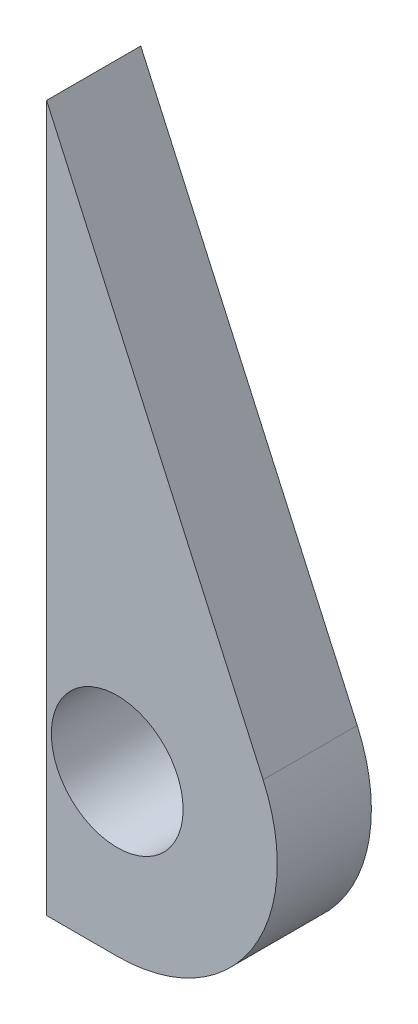
from build123d import *

# Parameters (mm, degrees)
SKETCH1_R           = 1.4
BOSS_EXTRUDE1_DEPTH = 2


with BuildPart() as part:
    # Sketch1 → Boss-Extrude1 (new body)
    with BuildSketch(Plane.XY):
        with BuildLine():
            Line((-1.5, -3.4), (-1.5, -1.4))
            Line((-1.5, -1.4), (-1.5, 3.6))
            Line((-1.5, 3.6), (-1.5, 11.6))
            Line((-1.5, 11.6), (3.099578521, 1.397359292))
            ThreePointArc((3.099578521, 1.397359292), (2.855785495, -1.845125796), (0, -3.4))
            Line((0, -3.4), (-1.5, -3.4))
        make_face()
        Circle(SKETCH1_R, mode=Mode.SUBTRACT)
    extrude(amount=BOSS_EXTRUDE1_DEPTH)


solid = part.part
